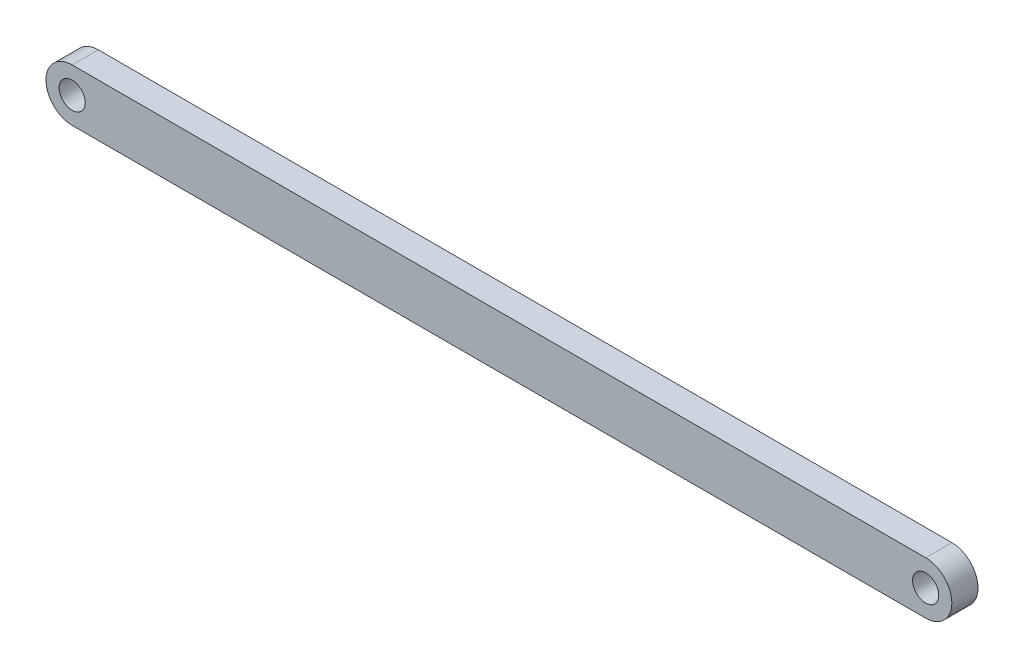
from build123d import *

# Parameters (mm, degrees)
SKETCH_1_R      = 2.5
EXTRUDE_3_DEPTH = 5


with BuildPart() as part:
    # 草图1 → 凸台-拉伸3 (new body)
    with BuildSketch(Plane.XY):
        with BuildLine():
            Line((0, 5), (163, 5))
            ThreePointArc((163, 5), (168, 0), (163, -5))
            Line((163, -5), (0, -5))
            ThreePointArc((0, -5), (-5, 0), (0, 5))
        make_face()
        Circle(SKETCH_1_R, mode=Mode.SUBTRACT)
        with Locations((163, 0)):
            Circle(SKETCH_1_R, mode=Mode.SUBTRACT)
    extrude(amount=EXTRUDE_3_DEPTH)


solid = part.part
